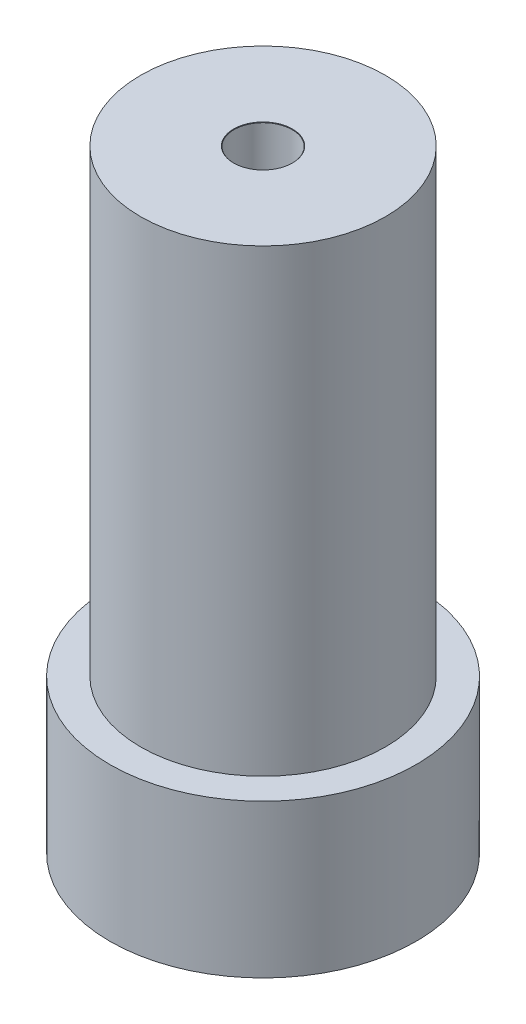
from build123d import *

# Parameters (mm, degrees)
SKETCH1_R                            = 10
BOSS_EXTRUDE1_DEPTH                  = 40
F_3_8_3_8_DIAMETER_HOLE1_D           = 3.8
F_3_8_3_8_DIAMETER_HOLE1_DEPTH       = 15
F_3_8_3_8_DIAMETER_HOLE1_CSINK_D     = 3.85
F_3_8_3_8_DIAMETER_HOLE1_CSINK_ANGLE = 90
F_3_8_3_8_DIAMETER_HOLE1_TIP         = 1.141635176
SKETCH5_R                            = 13.85296062
SKETCH5_R_2                          = 8
CUT_EXTRUDE1_DEPTH                   = 30


with BuildPart() as part:
    # Sketch1 → Boss-Extrude1 (new body)
    with BuildSketch(Plane(origin=(0, 0, 0), x_dir=(1, 0, 0), z_dir=(0, 1, 0))):
        with Locations(Location((0, 0, 0), (0, 0, 270))):
            Circle(SKETCH1_R)
    extrude(amount=BOSS_EXTRUDE1_DEPTH)

    # Ø3.8 (3.8) Diameter Hole1
    with Locations(Plane(origin=(0, 40, 0), x_dir=(1, 0, 0), z_dir=(0, 1, 0))):
        with Locations((0, 0)):
            CounterSinkHole(F_3_8_3_8_DIAMETER_HOLE1_D / 2, F_3_8_3_8_DIAMETER_HOLE1_CSINK_D / 2, depth=F_3_8_3_8_DIAMETER_HOLE1_DEPTH, counter_sink_angle=F_3_8_3_8_DIAMETER_HOLE1_CSINK_ANGLE)
            with Locations((0, 0, -(F_3_8_3_8_DIAMETER_HOLE1_DEPTH + F_3_8_3_8_DIAMETER_HOLE1_TIP / 2))):  # 118° drill point
                Cone(0, F_3_8_3_8_DIAMETER_HOLE1_D / 2, F_3_8_3_8_DIAMETER_HOLE1_TIP, mode=Mode.SUBTRACT)

    # Sketch5 → Cut-Extrude1 (cut)
    with BuildSketch(Plane(origin=(0, 40, 0), x_dir=(1, 0, 0), z_dir=(0, 1, 0))):
        Circle(SKETCH5_R)
        with Locations(Location((0, 0, 0), (0, 0, 270))):
            Circle(SKETCH5_R_2, mode=Mode.SUBTRACT)
    extrude(amount=-CUT_EXTRUDE1_DEPTH, mode=Mode.SUBTRACT)


solid = part.part
